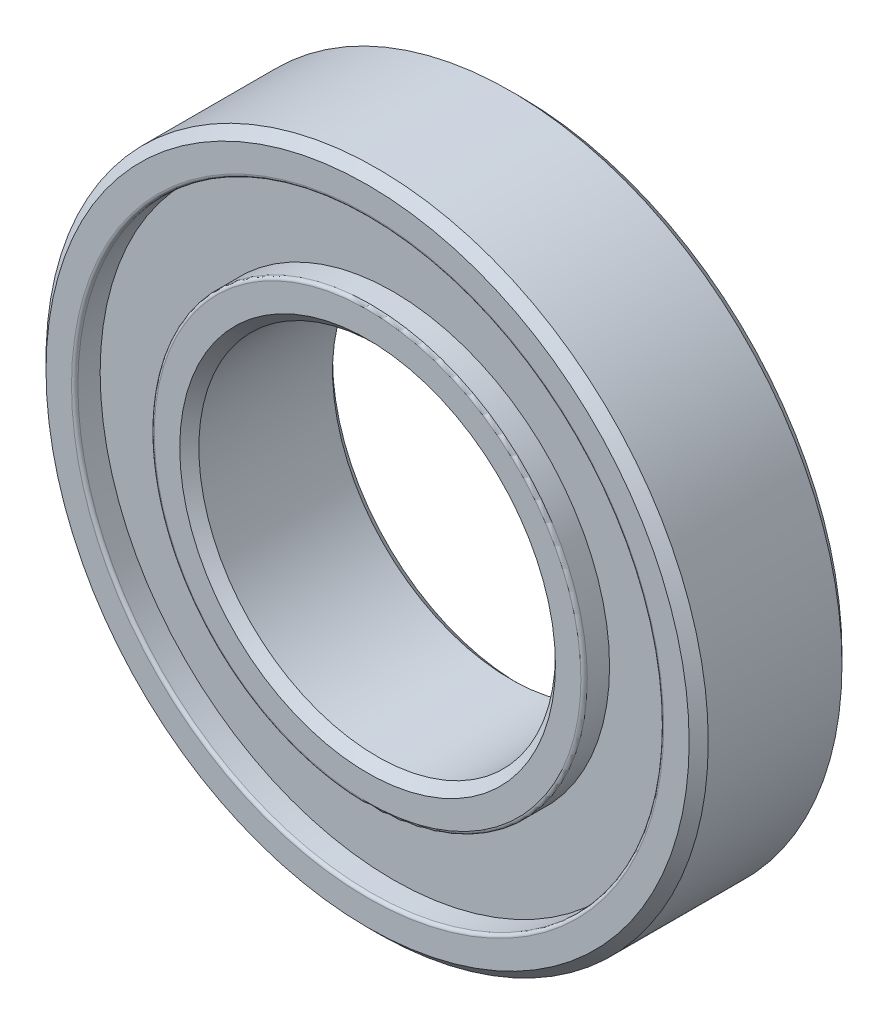
from build123d import *

# Parameters (mm, degrees)
SKETCH_1_R          = 26
SKETCH_1_R_2        = 14
EXTRUDE_1_DEPTH     = 6
SKETCH_2_R          = 23
SKETCH_2_R_2        = 17
CUT_EXTRUDE_1_DEPTH = 2
CHAMFER_1_SIZE      = 0.75
FILLET_1_R          = 0.25


with BuildPart() as part:
    # 草图1 → 凸台-拉伸1 (new, symmetric)
    with BuildSketch(Plane.XY):
        Circle(SKETCH_1_R)
        Circle(SKETCH_1_R_2, mode=Mode.SUBTRACT)
    extrude(amount=EXTRUDE_1_DEPTH, both=True)

    # 草图2 → 切除-拉伸1 (cut)
    with BuildSketch(Plane.XY.offset(6)):
        Circle(SKETCH_2_R)
        Circle(SKETCH_2_R_2, mode=Mode.SUBTRACT)
    cut_extrude_1 = extrude(amount=-CUT_EXTRUDE_1_DEPTH, mode=Mode.SUBTRACT)

    # 镜向1: 切除-拉伸1 across plane
    add(cut_extrude_1.mirror(Plane.XY), mode=Mode.SUBTRACT)

    # 倒角1
    chamfer_1_edges = [part.edges().sort_by_distance(p)[0] for p in [
        (-26, 0, -6),
        (-26, 0, 6),
        (-14, 0, -6),
        (-14, 0, 6),
    ]]
    chamfer(chamfer_1_edges, length=CHAMFER_1_SIZE)

    # 圆角1
    fillet_1_edges = [part.edges().sort_by_distance(p)[0] for p in [
        (-17, 0, 6),
        (-23, 0, 6),
        (-23, 0, -6),
        (-17, 0, -6),
    ]]
    fillet(fillet_1_edges, radius=FILLET_1_R)


solid = part.part
